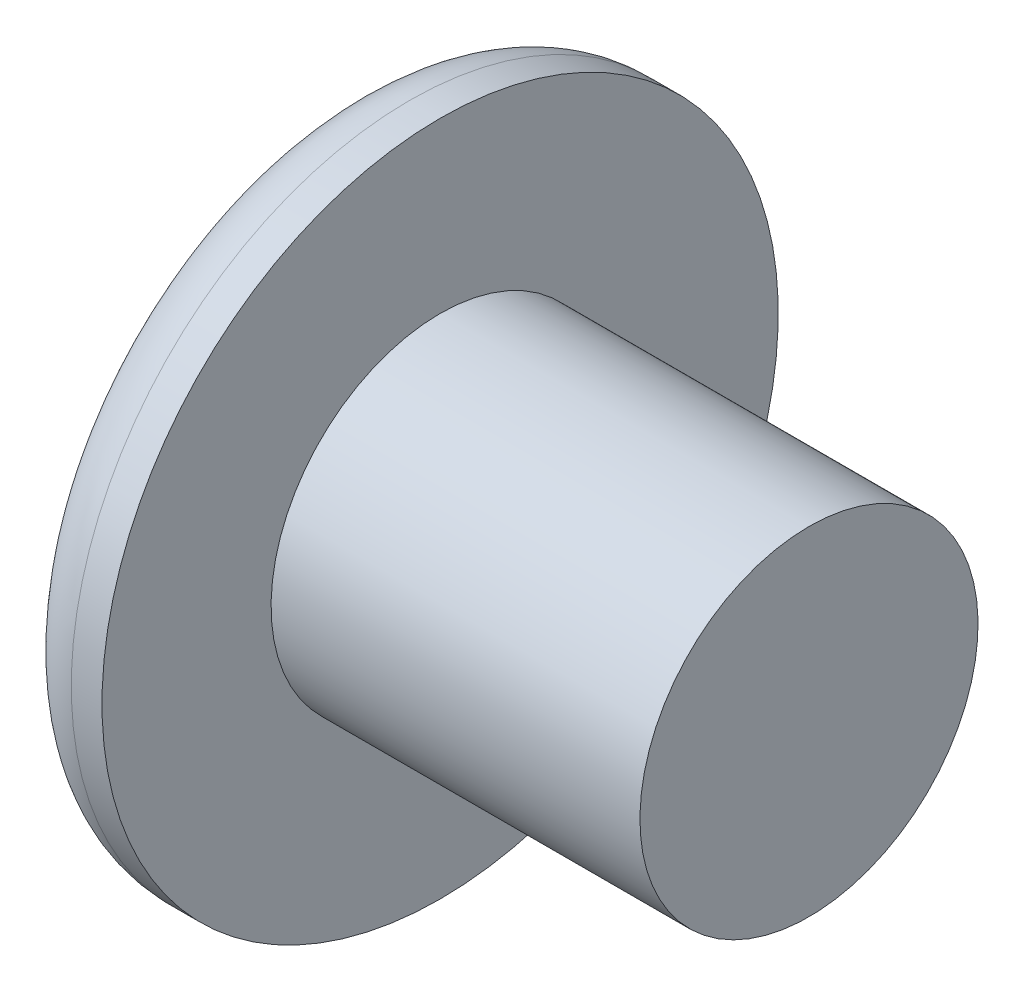
from build123d import *

# Parameters (mm, degrees)
SKETCH1_W   = 12
SKETCH1_H   = 5.5
SKETCH1_W_2 = 3
SKETCH1_H_2 = 11
FILLET1_R   = 2


with BuildPart() as part:
    # Sketch1 → Revolve1 (revolve)
    with BuildSketch(Plane.XY):
        with Locations((9, 2.75)):
            Rectangle(SKETCH1_W, SKETCH1_H)
        with Locations((1.5, 5.5)):
            Rectangle(SKETCH1_W_2, SKETCH1_H_2)
    revolve(axis=Axis((15, 0, 0), (-1, 0, 0)))

    # Fillet1
    fillet1_edges = [part.edges().sort_by_distance(p)[0] for p in [
        (0, -11, 0),
    ]]
    fillet(fillet1_edges, radius=FILLET1_R)


solid = part.part
